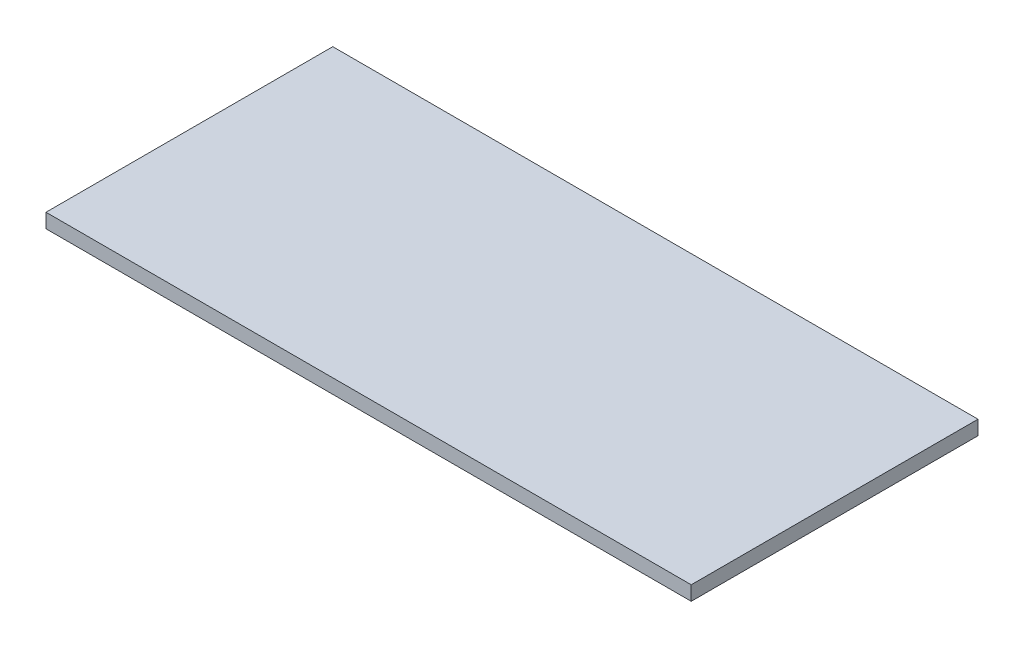
from build123d import *

# Parameters (mm, degrees)
SKETCH1_W           = 900
SKETCH1_H           = 400
BOSS_EXTRUDE1_DEPTH = 20


with BuildPart() as part:
    # Sketch1 → Boss-Extrude1 (new body)
    with BuildSketch(Plane(origin=(0, 0, 0), x_dir=(1, 0, 0), z_dir=(0, 1, 0))):
        Rectangle(SKETCH1_W, SKETCH1_H)
    extrude(amount=BOSS_EXTRUDE1_DEPTH)


solid = part.part
